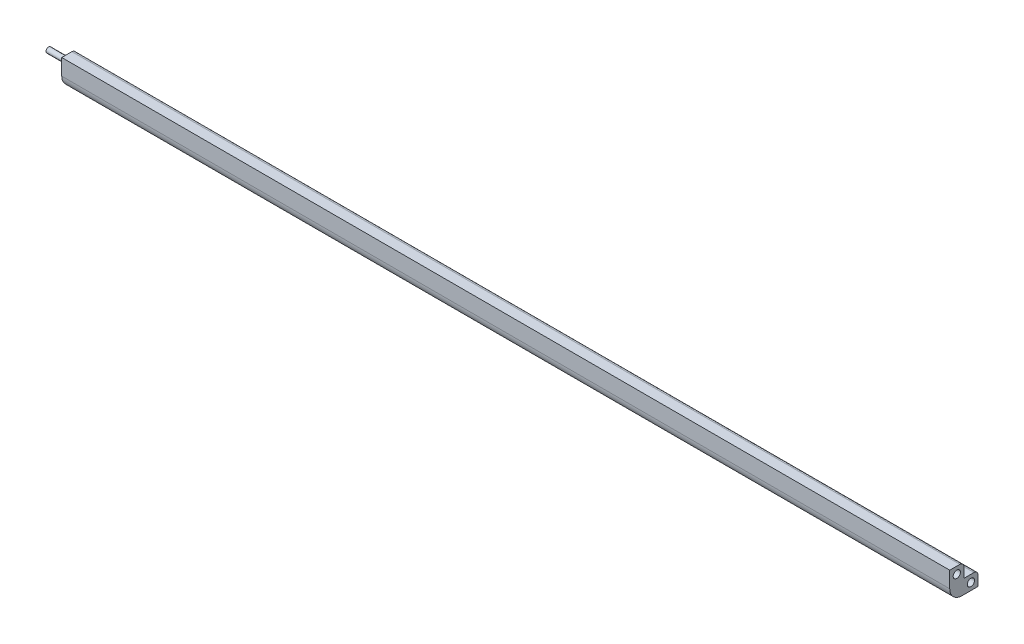
from build123d import *

# Parameters (mm, degrees)
BOSS_EXTRUDE1_DEPTH = 220
SKETCH2_R           = 0.9
CUT_EXTRUDE1_DEPTH  = 6
SKETCH1_3_R         = 0.65
BOSS_EXTRUDE2_DEPTH = 5
FILLET1_R           = 3
FILLET2_R           = 1


with BuildPart() as part:
    # Sketch1 → Boss-Extrude1 (new body)
    with BuildSketch(Plane(origin=(-29.212578399, 0, 0), x_dir=(0, 0, -1), z_dir=(1, 0, 0))):
        Polygon((7.945170891, 34.470791156), (4.445170891, 34.470791156), (4.445170891, 27.470791156), (11.445170891, 27.470791156), (11.445170891, 30.970791156), (7.945170891, 30.970791156), align=None)
    extrude(amount=BOSS_EXTRUDE1_DEPTH)

    # Sketch2 → Cut-Extrude1 (cut)
    with BuildSketch(Plane(origin=(190.787421601, 0, 0), x_dir=(0, 0, -1), z_dir=(1, 0, 0))):
        with Locations((6.195170891, 32.720791156)):
            Circle(SKETCH2_R)
        with Locations((9.695170891, 29.220791156)):
            Circle(SKETCH2_R)
    extrude(amount=-CUT_EXTRUDE1_DEPTH, mode=Mode.SUBTRACT)

    # Sketch1<3> → Boss-Extrude2 (add)
    with BuildSketch(Plane(origin=(-29.212578399, 0, 0), x_dir=(0, 0, -1), z_dir=(1, 0, 0))):
        with Locations((6.195170891, 32.720791156)):
            Circle(SKETCH1_3_R)
        with Locations((9.695170891, 29.220791156)):
            Circle(SKETCH1_3_R)
    extrude(amount=-BOSS_EXTRUDE2_DEPTH)

    # Fillet1
    fillet1_edges = [part.edges().sort_by_distance(p)[0] for p in [
        (80.787421601, 27.470791156, -4.445170891),
    ]]
    fillet(fillet1_edges, radius=FILLET1_R)

    # Fillet2
    fillet2_edges = [part.edges().sort_by_distance(p)[0] for p in [
        (80.787421601, 30.970791156, -11.445170891),
        (80.787421601, 34.470791156, -7.945170891),
    ]]
    fillet(fillet2_edges, radius=FILLET2_R)


solid = part.part
